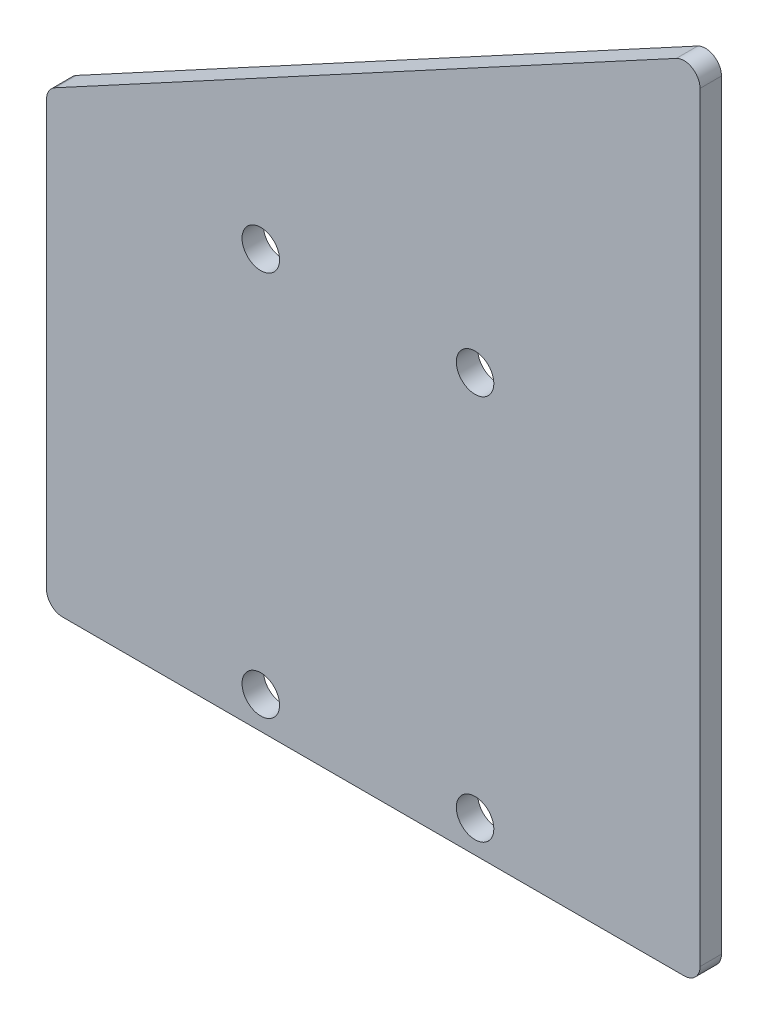
from build123d import *

# Parameters (mm, degrees)
SKETCH_1_W          = 61
SKETCH_1_H          = 42
SKETCH_1_R          = 1.75
EXTRUDE_1_DEPTH     = 2
EXTRUDE_2_DEPTH     = 2
SKETCH_3_OUTSIDE_W  = 82.34
SKETCH_3_OUTSIDE_H  = 96.34
CUT_EXTRUDE_1_DEPTH = 10


with BuildPart() as part:
    # 草图1 → 凸台-拉伸1 (new body)
    with BuildSketch(Plane.XY):
        with Locations((30.5, 21)):
            Rectangle(SKETCH_1_W, SKETCH_1_H)
        with Locations((20, 3)):
            Circle(SKETCH_1_R, mode=Mode.SUBTRACT)
        with Locations((40, 3)):
            Circle(SKETCH_1_R, mode=Mode.SUBTRACT)
        with Locations(Location((40, 39, 0), (0, 0, 180))):
            Circle(SKETCH_1_R, mode=Mode.SUBTRACT)
        with Locations(Location((20, 39, 0), (0, 0, 180))):
            Circle(SKETCH_1_R, mode=Mode.SUBTRACT)
    extrude(amount=EXTRUDE_1_DEPTH)

    # 草图2 → 凸台-拉伸2 (add)
    with BuildSketch(Plane.XY.offset(2)):
        Polygon((61, 75), (0, 42), (61, 42), align=None)
    extrude(amount=-EXTRUDE_2_DEPTH)

    # 草图3 outside → 切除-拉伸1 (cut)
    with BuildSketch(Plane.XY.offset(2)):
        with Locations((30.5, 37.5)):
            Rectangle(SKETCH_3_OUTSIDE_W, SKETCH_3_OUTSIDE_H)
        with BuildLine():
            Line((0, 41.106045159), (0, 1.5))
            ThreePointArc((0, 1.5), (0.439339828, 0.439339828), (1.5, 0))
            Line((1.5, 0), (59.5, 0))
            ThreePointArc((59.5, 0), (60.560660172, 0.439339828), (61, 1.5))
            Line((61, 1.5), (61, 72.483094339))
            ThreePointArc((61, 72.483094339), (60.26792193, 73.771619042), (58.786272122, 73.802409508))
            Line((58.786272122, 73.802409508), (0.786272122, 42.425360328))
            ThreePointArc((0.786272122, 42.425360328), (0.211475298, 41.873967089), (0, 41.106045159))
        make_face(mode=Mode.SUBTRACT)
    extrude(amount=-CUT_EXTRUDE_1_DEPTH, mode=Mode.SUBTRACT)


solid = part.part
